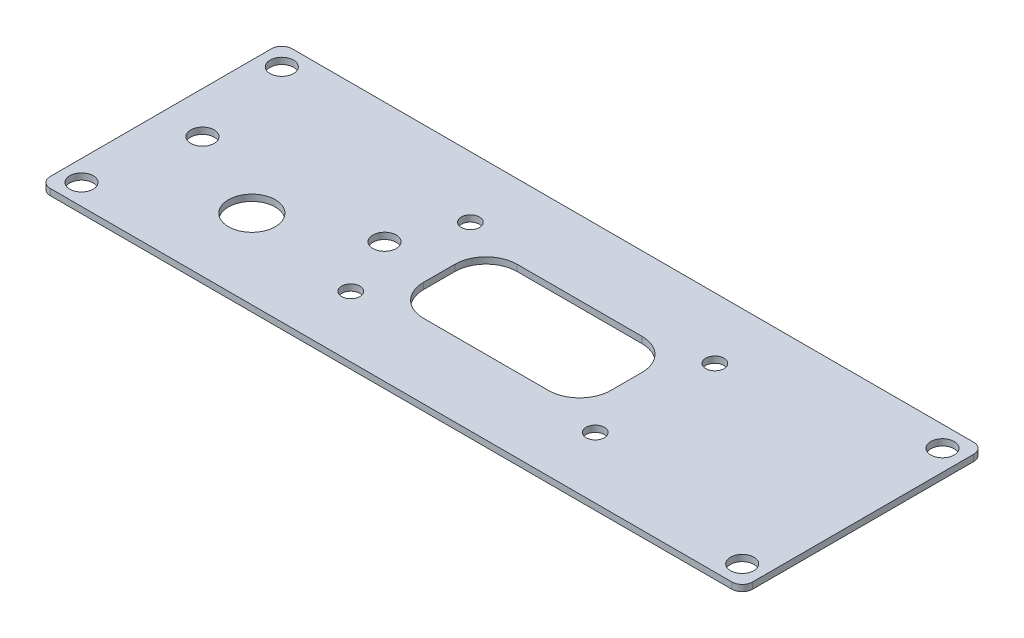
from build123d import *

# Parameters (mm, degrees)
BASE_R      = 2.25
BASE_R_2    = 1.75
BASE_R_3    = 4.5
SHEET_DEPTH = 1.2192


with BuildPart() as part:
    # BASE → SHEET (new body)
    with BuildSketch(Plane(origin=(0, 0, 0), x_dir=(1, 0, 0), z_dir=(0, 1, 0))):
        with BuildLine():
            Line((65.5, -23.25), (-65.5, -23.25))
            ThreePointArc((-65.5, -23.25), (-66.914213562, -22.664213562), (-67.5, -21.25))
            Line((-67.5, -21.25), (-67.5, 21.25))
            ThreePointArc((-67.5, 21.25), (-66.914213562, 22.664213562), (-65.5, 23.25))
            Line((-65.5, 23.25), (65.5, 23.25))
            ThreePointArc((65.5, 23.25), (66.914213562, 22.664213562), (67.5, 21.25))
            Line((67.5, 21.25), (67.5, -21.25))
            ThreePointArc((67.5, -21.25), (66.914213562, -22.664213562), (65.5, -23.25))
        make_face()
        with Locations(Location((-59.5, 0, 0), (0, 0, 270))):
            Circle(BASE_R, mode=Mode.SUBTRACT)
        with Locations(Location((-24.5, 0, 0), (0, 0, 270))):
            Circle(BASE_R, mode=Mode.SUBTRACT)
        with Locations(Location((-63.5, 19.25, 0), (0, 0, 270))):
            Circle(BASE_R, mode=Mode.SUBTRACT)
        with Locations(Location((-63.5, -19.25, 0), (0, 0, 270))):
            Circle(BASE_R, mode=Mode.SUBTRACT)
        with Locations(Location((63.5, -19.25, 0), (0, 0, 270))):
            Circle(BASE_R, mode=Mode.SUBTRACT)
        with Locations(Location((63.5, 19.25, 0), (0, 0, 270))):
            Circle(BASE_R, mode=Mode.SUBTRACT)
        with Locations(Location((-19.5, 11.5, 0), (0, 0, 270))):
            Circle(BASE_R_2, mode=Mode.SUBTRACT)
        with Locations(Location((27.5, 11.5, 0), (0, 0, 270))):
            Circle(BASE_R_2, mode=Mode.SUBTRACT)
        with Locations(Location((27.5, -11.5, 0), (0, 0, 270))):
            Circle(BASE_R_2, mode=Mode.SUBTRACT)
        with Locations(Location((-19.5, -11.5, 0), (0, 0, 270))):
            Circle(BASE_R_2, mode=Mode.SUBTRACT)
        with Locations(Location((-42, -8, 0), (0, 0, 270))):
            Circle(BASE_R_3, mode=Mode.SUBTRACT)
        with BuildLine():
            Line((-8, -9), (16, -9))
            ThreePointArc((16, -9), (20.242640687, -7.242640687), (22, -3))
            Line((22, -3), (22, 3))
            ThreePointArc((22, 3), (20.242640687, 7.242640687), (16, 9))
            Line((16, 9), (-8, 9))
            ThreePointArc((-8, 9), (-12.242640687, 7.242640687), (-14, 3))
            Line((-14, 3), (-14, -3))
            ThreePointArc((-14, -3), (-12.242640687, -7.242640687), (-8, -9))
        make_face(mode=Mode.SUBTRACT)
    extrude(amount=SHEET_DEPTH)


solid = part.part
